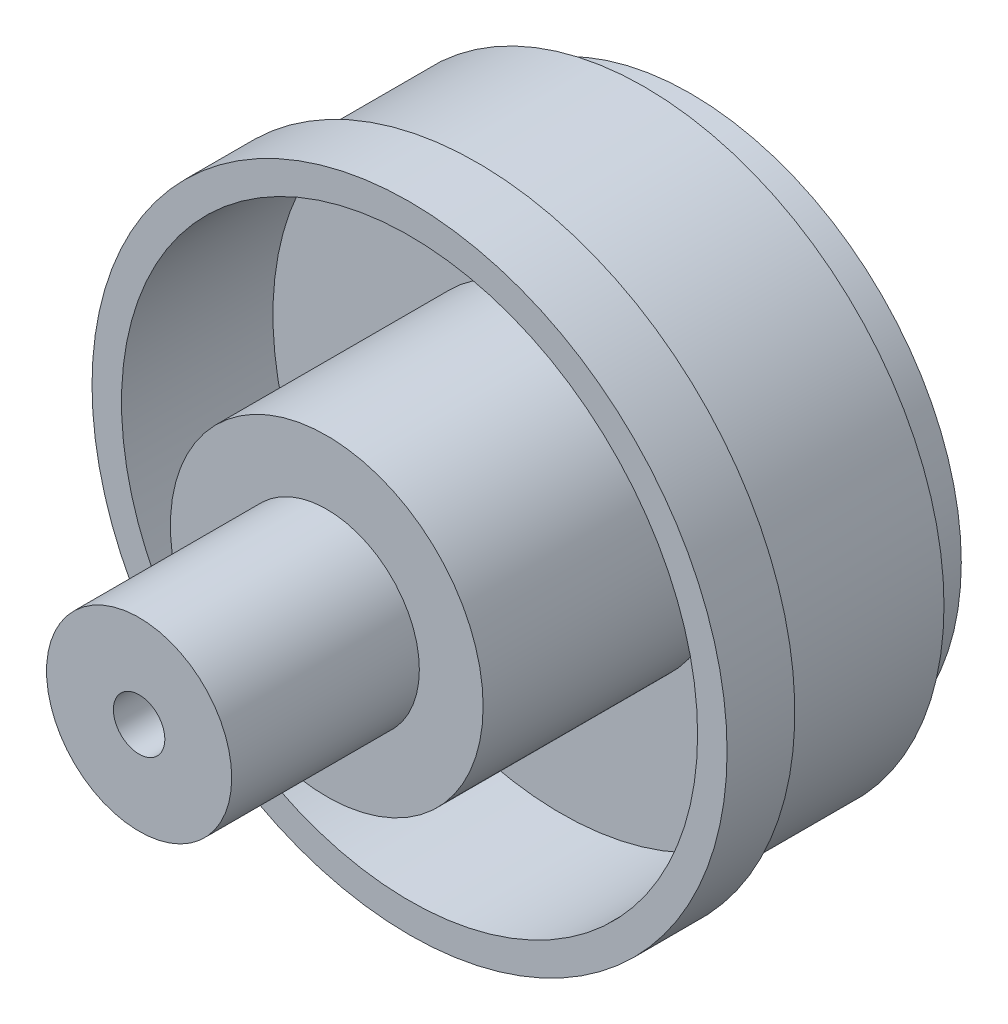
from build123d import *

# Parameters (mm, degrees)
SKETCH1_R         = 49
EXTRUDE1_DEPTH    = 85.09
SKETCH5_R         = 3.96875
EXTRUDE5_DEPTH    = 26.67
SKETCH2_OUTSIDE_W = 132.526
SKETCH2_OUTSIDE_H = 132.526
SKETCH2_OUTSIDE_R = 14.2875
EXTRUDE2_DEPTH    = 28.956
SKETCH3_OUTSIDE_W = 132.526
SKETCH3_OUTSIDE_H = 132.526
SKETCH3_OUTSIDE_R = 24.13
EXTRUDE3_DEPTH    = 12.7762
SKETCH4_OUTSIDE_W = 132.526
SKETCH4_OUTSIDE_H = 132.526
SKETCH4_OUTSIDE_R = 46.228
EXTRUDE4_DEPTH    = 32.9057
SKETCH6_R         = 44.45
SKETCH6_R_2       = 24.13
EXTRUDE8_DEPTH    = 23.368
SKETCH7_R         = 19.05
EXTRUDE9_DEPTH    = 50.8
SKETCH8_OUTSIDE_W = 132.526
SKETCH8_OUTSIDE_H = 132.526
SKETCH8_OUTSIDE_R = 41.783
EXTRUDE10_DEPTH   = 7.112


with BuildPart() as part:
    # Sketch1 → Extrude1 (new body)
    with BuildSketch(Plane.XY):
        Circle(SKETCH1_R)
    extrude(amount=EXTRUDE1_DEPTH)

    # Sketch5 → Extrude5 (cut)
    with BuildSketch(Plane.XY.offset(85.09)):
        Circle(SKETCH5_R)
    extrude(amount=-EXTRUDE5_DEPTH, mode=Mode.SUBTRACT)

    # Sketch2 outside → Extrude2 (cut)
    with BuildSketch(Plane.XY.offset(85.09)):
        Rectangle(SKETCH2_OUTSIDE_W, SKETCH2_OUTSIDE_H)
        Circle(SKETCH2_OUTSIDE_R, mode=Mode.SUBTRACT)
    extrude(amount=-EXTRUDE2_DEPTH, mode=Mode.SUBTRACT)

    # Sketch3 outside → Extrude3 (cut)
    with BuildSketch(Plane.XY.offset(56.134)):
        Rectangle(SKETCH3_OUTSIDE_W, SKETCH3_OUTSIDE_H)
        Circle(SKETCH3_OUTSIDE_R, mode=Mode.SUBTRACT)
    extrude(amount=-EXTRUDE3_DEPTH, mode=Mode.SUBTRACT)

    # Sketch4 outside → Extrude4 (cut)
    with BuildSketch(Plane(origin=(0, 0, 0), x_dir=(-1, 0, 0), z_dir=(0, 0, -1))):
        Rectangle(SKETCH4_OUTSIDE_W, SKETCH4_OUTSIDE_H)
        Circle(SKETCH4_OUTSIDE_R, mode=Mode.SUBTRACT)
    extrude(amount=-EXTRUDE4_DEPTH, mode=Mode.SUBTRACT)

    # Sketch6 → Extrude8 (cut)
    with BuildSketch(Plane.XY.offset(43.3578)):
        Circle(SKETCH6_R)
        Circle(SKETCH6_R_2, mode=Mode.SUBTRACT)
    extrude(amount=-EXTRUDE8_DEPTH, mode=Mode.SUBTRACT)

    # Sketch7 → Extrude9 (cut)
    with BuildSketch(Plane(origin=(0, 0, 0), x_dir=(-1, 0, 0), z_dir=(0, 0, -1))):
        Circle(SKETCH7_R)
    extrude(amount=-EXTRUDE9_DEPTH, mode=Mode.SUBTRACT)

    # Sketch8 outside → Extrude10 (cut)
    with BuildSketch(Plane(origin=(0, 0, 0), x_dir=(-1, 0, 0), z_dir=(0, 0, -1))):
        Rectangle(SKETCH8_OUTSIDE_W, SKETCH8_OUTSIDE_H)
        Circle(SKETCH8_OUTSIDE_R, mode=Mode.SUBTRACT)
    extrude(amount=-EXTRUDE10_DEPTH, mode=Mode.SUBTRACT)


solid = part.part
